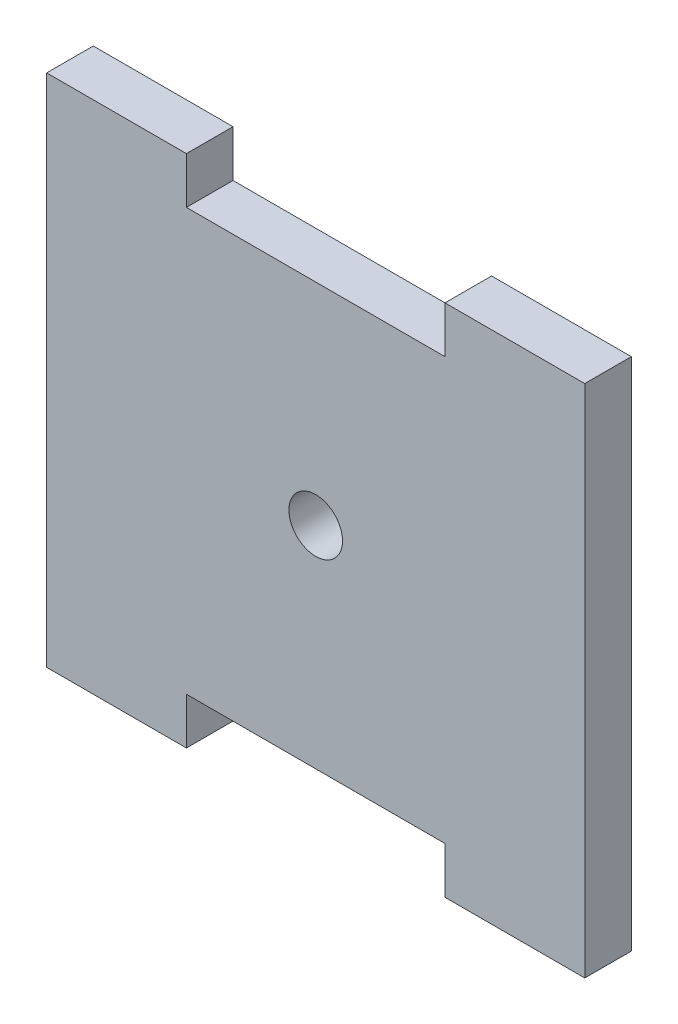
from build123d import *

# Parameters (mm, degrees)
SKETCH_1_R      = 1.15
EXTRUDE_1_DEPTH = 2


with BuildPart() as part:
    # 草图1 → 凸台-拉伸1 (new body)
    with BuildSketch(Plane.XY):
        Polygon((-3, 1), (3, 1), (3, -1), (14.1, -1), (14.1, 1), (20.1, 1), (20.1, -1), (20.1, -19.1), (20.1, -21.1), (14.1, -21.1), (14.1, -19.1), (3, -19.1), (3, -21.1), (-3, -21.1), (-3, -19.1), (-3, -1), align=None)
        with Locations((8.55, -10.05)):
            Circle(SKETCH_1_R, mode=Mode.SUBTRACT)
    extrude(amount=EXTRUDE_1_DEPTH)


solid = part.part
